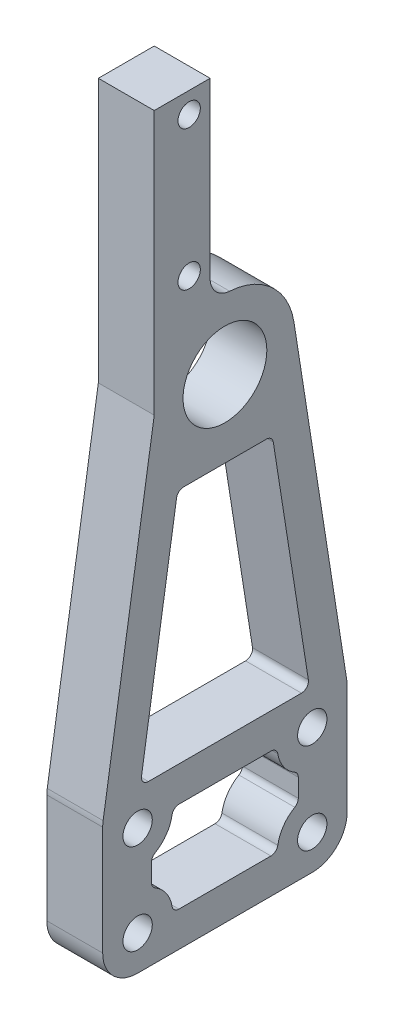
from build123d import *

# Parameters (mm, degrees)
SKETCH_1_R          = 6
SKETCH_1_R_2        = 2.1
SKETCH_1_R_3        = 1.6
EXTRUDE_1_DEPTH     = 8
CUT_EXTRUDE_2_DEPTH = 71.670007783
FILLET_1_R          = 5


with BuildPart() as part:
    # 草图1 → 凸台-拉伸1 (new body)
    with BuildSketch(Plane(origin=(0, 0, 0), x_dir=(0, 0, -1), z_dir=(1, 0, 0))):
        with BuildLine():
            Line((-17.5, -47), (-17.5, -68))
            Line((-17.5, -68), (17.5, -68))
            Line((17.5, -68), (17.5, -47))
            Line((17.5, -47), (9.879034185, 1.550704218))
            ThreePointArc((9.879034185, 1.550704218), (6.75266911, 7.375734533), (0.675040765, 9.977189983))
            ThreePointArc((0.675040765, 9.977189983), (-1.314197069, 10.921876413), (-2.122447005, 12.970346978))
            Line((-2.122447005, 12.970346978), (-2.122447005, 37.772165508))
            Line((-2.122447005, 37.772165508), (-10.122447005, 37.772165508))
            Line((-10.122447005, 37.772165508), (-10.122447005, 0))
            Line((-10.122447005, 0), (-17.5, -47))
        make_face()
        Circle(SKETCH_1_R, mode=Mode.SUBTRACT)
        with Locations((-12.5, -50)):
            Circle(SKETCH_1_R_2, mode=Mode.SUBTRACT)
        with Locations((12.5, -50)):
            Circle(SKETCH_1_R_2, mode=Mode.SUBTRACT)
        with Locations((-12.5, -63)):
            Circle(SKETCH_1_R_2, mode=Mode.SUBTRACT)
        with Locations((12.5, -63)):
            Circle(SKETCH_1_R_2, mode=Mode.SUBTRACT)
        with Locations((-5.122447005, 34.772165508)):
            Circle(SKETCH_1_R_3, mode=Mode.SUBTRACT)
        with Locations((-5.122447005, 14.772165508)):
            Circle(SKETCH_1_R_3, mode=Mode.SUBTRACT)
    extrude(amount=EXTRUDE_1_DEPTH)

    # 草图3 → 切除-拉伸2 (cut, through all)
    with BuildSketch(Plane(origin=(8, 0, 0), x_dir=(0, 0, -1), z_dir=(1, 0, 0))):
        with BuildLine():
            Line((-6.920512772, -11.844929578), (-11.943527577, -43.844929578))
            ThreePointArc((-11.943527577, -43.844929578), (-11.715581533, -44.649972914), (-10.955624159, -45))
            Line((-10.955624159, -45), (10.955624159, -45))
            ThreePointArc((10.955624159, -45), (11.715581533, -44.649972914), (11.943527577, -43.844929578))
            Line((11.943527577, -43.844929578), (6.920512772, -11.844929578))
            ThreePointArc((6.920512772, -11.844929578), (6.582582268, -11.240042626), (5.932609354, -11))
            Line((5.932609354, -11), (-5.932609354, -11))
            ThreePointArc((-5.932609354, -11), (-6.582582268, -11.240042626), (-6.920512772, -11.844929578))
        make_face()
        with BuildLine():
            Line((-10.5, -55.196152423), (-10.5, -57.803847577))
            ThreePointArc((-10.5, -57.803847577), (-10.366025404, -58.303847577), (-10, -58.669872981))
            ThreePointArc((-10, -58.669872981), (-8.394106246, -60.146644697), (-7.569933514, -62.166666667))
            ThreePointArc((-7.569933514, -62.166666667), (-7.229417441, -62.763762616), (-6.583920217, -63))
            Line((-6.583920217, -63), (6.583920217, -63))
            ThreePointArc((6.583920217, -63), (7.229417441, -62.763762616), (7.569933514, -62.166666667))
            ThreePointArc((7.569933514, -62.166666667), (8.394106246, -60.146644697), (10, -58.669872981))
            ThreePointArc((10, -58.669872981), (10.366025404, -58.303847577), (10.5, -57.803847577))
            Line((10.5, -57.803847577), (10.5, -55.196152423))
            ThreePointArc((10.5, -55.196152423), (10.366025404, -54.696152423), (10, -54.330127019))
            ThreePointArc((10, -54.330127019), (8.394106246, -52.853355303), (7.569933514, -50.833333333))
            ThreePointArc((7.569933514, -50.833333333), (7.229417441, -50.236237384), (6.583920217, -50))
            Line((6.583920217, -50), (-6.583920217, -50))
            ThreePointArc((-6.583920217, -50), (-7.229417441, -50.236237384), (-7.569933514, -50.833333333))
            ThreePointArc((-7.569933514, -50.833333333), (-8.394106246, -52.853355303), (-10, -54.330127019))
            ThreePointArc((-10, -54.330127019), (-10.366025404, -54.696152423), (-10.5, -55.196152423))
        make_face()
    extrude(amount=-CUT_EXTRUDE_2_DEPTH, mode=Mode.SUBTRACT)

    # 圆角1
    fillet_1_edges = [part.edges().sort_by_distance(p)[0] for p in [
        (4, -47, -17.5),
        (4, -68, -17.5),
        (4, -68, 17.5),
        (4, -47, 17.5),
    ]]
    fillet(fillet_1_edges, radius=FILLET_1_R)


solid = part.part
